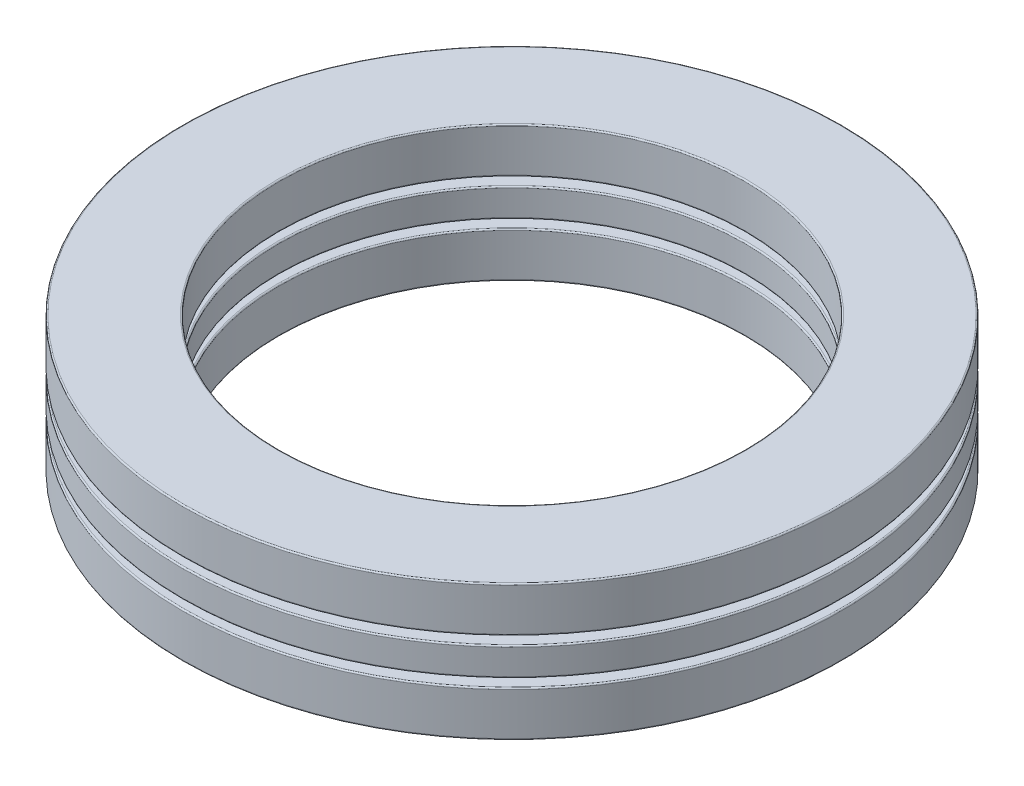
from build123d import *

# Parameters (mm, degrees)
SKETCH1_W         = 7.8994
SKETCH1_H         = 2.312458334
CIRPATTERN1_COUNT = 11
CIRPATTERN1_ANGLE = 327.272727273
CIRPATTERN2_COUNT = 11
SKETCH4_W         = 7.8994
SKETCH4_H         = 3.699933333
FILLET1_R         = 0.110998
FILLET2_R         = 0.110998
FILLET3_R         = 0.110998


with BuildPart() as part:
    # Sketch1 → Revolve1 (revolve)
    with BuildSketch(Plane(origin=(0, 0, 0), x_dir=(0, 0, -1), z_dir=(1, 0, 0)), mode=Mode.PRIVATE) as revolve1_sk:
        with Locations((-23.0378, 0)):
            Rectangle(SKETCH1_W, SKETCH1_H)
    revolve(revolve1_sk.sketch.rotate(Axis((0, -5.5499, 0), (0, 1, 0)), 180), axis=Axis((0, -5.5499, 0), (0, 1, 0)))

    # Sketch3 → Cut-Revolve1 (revolve, cut)
    with BuildSketch(Plane(origin=(0, 0, 0), x_dir=(0, 0, -1), z_dir=(1, 0, 0))):
        with BuildLine():
            Line((-23.0378, 1.849966667), (-23.0378, -1.849966667))
            ThreePointArc((-23.0378, -1.849966667), (-24.887766667, 0), (-23.0378, 1.849966667))
        make_face()
    cut_revolve1 = revolve(axis=Axis((0, 1.849966667, 23.0378), (0, -1, 0)), mode=Mode.SUBTRACT)

    # CirPattern2: Cut-Revolve1 ×11 about axis
    cirpattern2_axis = Axis((0, 0, 0), (0, 1, 0))
    for i in range(1, CIRPATTERN2_COUNT):
        add(cut_revolve1.rotate(cirpattern2_axis, i * 360 / CIRPATTERN2_COUNT), mode=Mode.SUBTRACT)

    # Fillet2
    fillet2_edges = [part.edges().sort_by_distance(p)[0] for p in [
        (0, 1.156229167, 26.9875),
        (0, 1.156229167, 19.0881),
        (0, -1.156229167, 19.0881),
        (0, -1.156229167, 26.9875),
    ]]
    fillet(fillet2_edges, radius=FILLET2_R)


with BuildPart() as body_2:
    # Sketch2 → Revolve2 (revolve)
    with BuildSketch(Plane(origin=(0, 0, 0), x_dir=(0, 0, -1), z_dir=(1, 0, 0))):
        with BuildLine():
            Line((-23.0378, 1.849966667), (-23.0378, -1.849966667))
            ThreePointArc((-23.0378, -1.849966667), (-24.887766667, 0), (-23.0378, 1.849966667))
        make_face()
    revolve(axis=Axis((0, 1.849966667, 23.0378), (0, -1, 0)))


with BuildPart() as cirpattern1_1:
    # CirPattern1: pattern copy
    add(body_2.part.rotate(Axis((0, 5.5499, 0), (0, -1, 0)), 1 * CIRPATTERN1_ANGLE / (CIRPATTERN1_COUNT - 1)))


with BuildPart() as cirpattern1_2:
    # CirPattern1: pattern copy
    add(body_2.part.rotate(Axis((0, 5.5499, 0), (0, -1, 0)), 2 * CIRPATTERN1_ANGLE / (CIRPATTERN1_COUNT - 1)))


with BuildPart() as cirpattern1_3:
    # CirPattern1: pattern copy
    add(body_2.part.rotate(Axis((0, 5.5499, 0), (0, -1, 0)), 3 * CIRPATTERN1_ANGLE / (CIRPATTERN1_COUNT - 1)))


with BuildPart() as cirpattern1_4:
    # CirPattern1: pattern copy
    add(body_2.part.rotate(Axis((0, 5.5499, 0), (0, -1, 0)), 4 * CIRPATTERN1_ANGLE / (CIRPATTERN1_COUNT - 1)))


with BuildPart() as cirpattern1_5:
    # CirPattern1: pattern copy
    add(body_2.part.rotate(Axis((0, 5.5499, 0), (0, -1, 0)), 5 * CIRPATTERN1_ANGLE / (CIRPATTERN1_COUNT - 1)))


with BuildPart() as cirpattern1_6:
    # CirPattern1: pattern copy
    add(body_2.part.rotate(Axis((0, 5.5499, 0), (0, -1, 0)), 6 * CIRPATTERN1_ANGLE / (CIRPATTERN1_COUNT - 1)))


with BuildPart() as cirpattern1_7:
    # CirPattern1: pattern copy
    add(body_2.part.rotate(Axis((0, 5.5499, 0), (0, -1, 0)), 7 * CIRPATTERN1_ANGLE / (CIRPATTERN1_COUNT - 1)))


with BuildPart() as cirpattern1_8:
    # CirPattern1: pattern copy
    add(body_2.part.rotate(Axis((0, 5.5499, 0), (0, -1, 0)), 8 * CIRPATTERN1_ANGLE / (CIRPATTERN1_COUNT - 1)))


with BuildPart() as cirpattern1_9:
    # CirPattern1: pattern copy
    add(body_2.part.rotate(Axis((0, 5.5499, 0), (0, -1, 0)), 9 * CIRPATTERN1_ANGLE / (CIRPATTERN1_COUNT - 1)))


with BuildPart() as cirpattern1_10:
    # CirPattern1: pattern copy
    add(body_2.part.rotate(Axis((0, 5.5499, 0), (0, -1, 0)), 10 * CIRPATTERN1_ANGLE / (CIRPATTERN1_COUNT - 1)))


with BuildPart() as body_13:
    # Sketch4 → Revolve3 (revolve)
    with BuildSketch(Plane(origin=(0, 0, 0), x_dir=(0, 0, -1), z_dir=(1, 0, 0)), mode=Mode.PRIVATE) as revolve3_sk:
        with Locations((-23.0378, 3.699933334)):
            Rectangle(SKETCH4_W, SKETCH4_H)
        with Locations((-23.0378, -3.699933334)):
            Rectangle(SKETCH4_W, SKETCH4_H)
    revolve(revolve3_sk.sketch.rotate(Axis((0, -5.5499, 0), (0, 1, 0)), 180), axis=Axis((0, -5.5499, 0), (0, 1, 0)))

    # Fillet1
    fillet1_edges = [body_13.edges().sort_by_distance(p)[0] for p in [
        (0, 1.849966667, 26.9875),
        (0, 1.849966667, 19.0881),
        (0, 5.5499, 19.0881),
        (0, 5.5499, 26.9875),
    ]]
    fillet(fillet1_edges, radius=FILLET1_R)

    # Fillet3
    fillet3_edges = [body_13.edges().sort_by_distance(p)[0] for p in [
        (0, -5.5499, 26.9875),
        (0, -5.5499, 19.0881),
        (0, -1.849966667, 19.0881),
        (0, -1.849966667, 26.9875),
    ]]
    fillet(fillet3_edges, radius=FILLET3_R)


solid = Compound([part.part, body_2.part, cirpattern1_1.part, cirpattern1_2.part, cirpattern1_3.part, cirpattern1_4.part, cirpattern1_5.part, cirpattern1_6.part, cirpattern1_7.part, cirpattern1_8.part, cirpattern1_9.part, cirpattern1_10.part, body_13.part])
